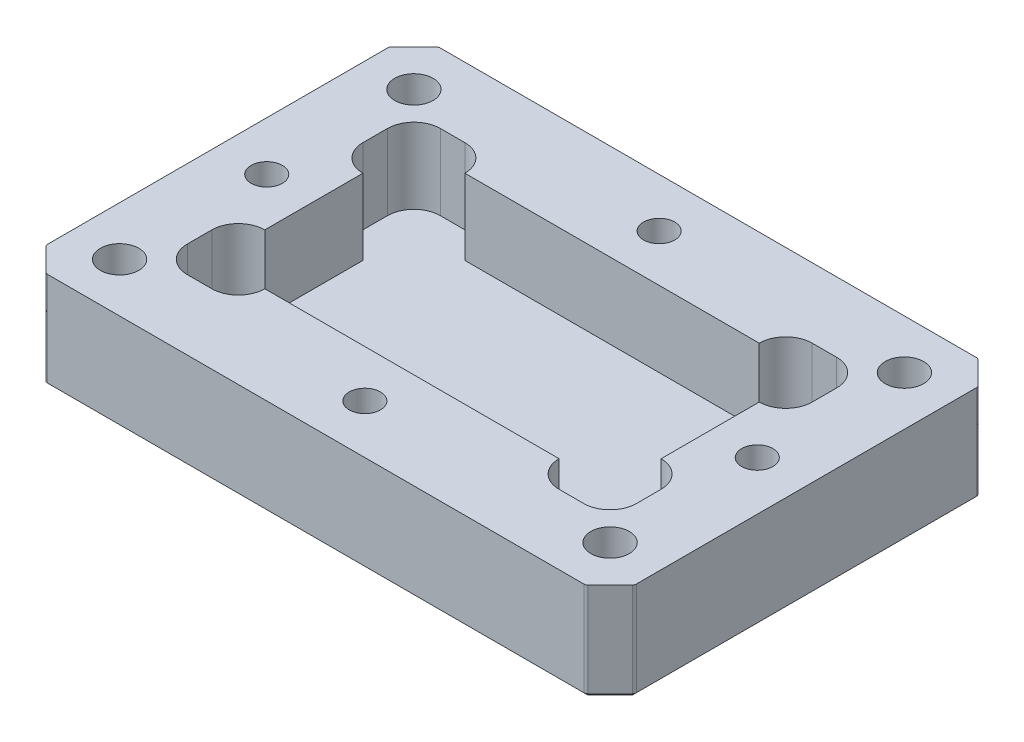
from build123d import *

# Parameters (mm, degrees)
SKETCH1_W                                      = 76.2
SKETCH1_H                                      = 50.8
BOSS_EXTRUDE1_DEPTH                            = 12.7
SKETCH2_W                                      = 51.308
SKETCH2_H                                      = 25.908
CUT_EXTRUDE1_DEPTH                             = 9.779
CUT_EXTRUDE2_DEPTH                             = 9.779
MIRROR2_COPY_1_DEPTH                           = 9.779
CBORE_FOR_10_SOCKET_HEAD_CAP_SCREW_D           = 4.9784
CBORE_FOR_10_SOCKET_HEAD_CAP_SCREW_CBORE_D     = 8.89
CBORE_FOR_10_SOCKET_HEAD_CAP_SCREW_CBORE_DEPTH = 5.08
CHAMFER1_SIZE                                  = 3.175
FILLET1_R                                      = 0.508
CHAMFER2_SIZE                                  = 0.508
F_10_32_TAPPED_HOLE1_D                         = 4.0386
CHAMFER3_SIZE                                  = 0.508


with BuildPart() as part:
    # Sketch1 → Boss-Extrude1 (new body)
    with BuildSketch(Plane(origin=(0, 0, 0), x_dir=(1, 0, 0), z_dir=(0, 1, 0))):
        Rectangle(SKETCH1_W, SKETCH1_H)
    extrude(amount=BOSS_EXTRUDE1_DEPTH)

    # Sketch2 → Cut-Extrude1 (cut)
    with BuildSketch(Plane(origin=(0, 12.7, 0), x_dir=(1, 0, 0), z_dir=(0, 1, 0))):
        Rectangle(SKETCH2_W, SKETCH2_H)
    extrude(amount=-CUT_EXTRUDE1_DEPTH, mode=Mode.SUBTRACT)

    # Sketch3 → Cut-Extrude2 (cut)
    with BuildSketch(Plane(origin=(0, 12.7, 0), x_dir=(1, 0, 0), z_dir=(0, 1, 0))):
        with BuildLine():
            Line((-22.479, 16.383), (-25.654, 16.383))
            ThreePointArc((-25.654, 16.383), (-28.078669153, 15.378669153), (-29.083, 12.954))
            Line((-29.083, 12.954), (-29.083, 9.779))
            ThreePointArc((-29.083, 9.779), (-26.96622149, 6.611017083), (-23.229330847, 7.354330847))
            Line((-23.229330847, 7.354330847), (-20.054330847, 10.529330847))
            ThreePointArc((-20.054330847, 10.529330847), (-19.311017083, 14.26622149), (-22.479, 16.383))
        make_face()
    cut_extrude2 = extrude(amount=-CUT_EXTRUDE2_DEPTH, mode=Mode.SUBTRACT)

    # Mirror1: Cut-Extrude2 across plane
    add(cut_extrude2.mirror(Plane.XY), mode=Mode.SUBTRACT)

    # Mirror2: Cut-Extrude2 across plane
    add(cut_extrude2.mirror(Plane(origin=(0, 0, 0), x_dir=(0, 0, 1), z_dir=(1, 0, 0))), mode=Mode.SUBTRACT)

    # Mirror2 copy 1 sketch → Mirror2 copy 1 (cut)
    with BuildSketch(Plane(origin=(0, 12.7, 0), x_dir=(-1, 0, 0), z_dir=(0, 1, 0))):
        with BuildLine():
            Line((-22.479, 16.383), (-25.654, 16.383))
            ThreePointArc((-25.654, 16.383), (-28.078669153, 15.378669153), (-29.083, 12.954))
            Line((-29.083, 12.954), (-29.083, 9.779))
            ThreePointArc((-29.083, 9.779), (-26.96622149, 6.611017083), (-23.229330847, 7.354330847))
            Line((-23.229330847, 7.354330847), (-20.054330847, 10.529330847))
            ThreePointArc((-20.054330847, 10.529330847), (-19.311017083, 14.26622149), (-22.479, 16.383))
        make_face()
    extrude(amount=-MIRROR2_COPY_1_DEPTH, mode=Mode.SUBTRACT)

    # CBORE for #10 Socket Head Cap Screw (through all)
    with Locations(Plane(origin=(-13.395092078, 0, 69.634435184), x_dir=(1, 0, 0), z_dir=(0, -1, 0))):
        with Locations((-18.354907922, -50.584435184), (45.145092078, -50.584435184), (45.145092078, -88.684435184), (-18.354907922, -88.684435184)):
            CounterBoreHole(CBORE_FOR_10_SOCKET_HEAD_CAP_SCREW_D / 2, CBORE_FOR_10_SOCKET_HEAD_CAP_SCREW_CBORE_D / 2, CBORE_FOR_10_SOCKET_HEAD_CAP_SCREW_CBORE_DEPTH)

    # Chamfer1
    chamfer1_edges = [part.edges().sort_by_distance(p)[0] for p in [
        (38.1, 6.35, 25.4),
        (-38.1, 6.35, 25.4),
        (-38.1, 6.35, -25.4),
        (38.1, 6.35, -25.4),
    ]]
    chamfer(chamfer1_edges, length=CHAMFER1_SIZE)

    # Fillet1
    fillet1_edges = [part.edges().sort_by_distance(p)[0] for p in [
        (38.1, 6.35, -22.225),
        (38.1, 6.35, 22.225),
        (-34.925, 6.35, 25.4),
        (34.925, 6.35, 25.4),
        (-34.925, 6.35, -25.4),
        (34.925, 6.35, -25.4),
        (-38.1, 6.35, -22.225),
        (-38.1, 6.35, 22.225),
    ]]
    fillet(fillet1_edges, radius=FILLET1_R)

    # Chamfer2
    chamfer2_edges = [part.edges().sort_by_distance(p)[0] for p in [
        (-38.1, 0, 0),
        (38.1, 0, 0),
        (36.5125, 0, 23.8125),
        (0, 0, 25.4),
        (-36.5125, 0, 23.8125),
        (-36.5125, 0, -23.8125),
        (0, 0, -25.4),
        (36.5125, 0, -23.8125),
        (-34.908982694, 0, 25.361330803),
        (-38.061330803, 0, 22.208982694),
        (34.908982694, 0, 25.361330803),
        (38.061330803, 0, 22.208982694),
        (38.061330803, 0, -22.208982694),
        (34.908982694, 0, -25.361330803),
        (-34.908982694, 0, -25.361330803),
        (-38.061330803, 0, -22.208982694),
    ]]
    chamfer(chamfer2_edges, length=CHAMFER2_SIZE)

    # #10-32 Tapped Hole1 (through all)
    with Locations(Plane(origin=(0, 0, 0), x_dir=(-1, 0, 0), z_dir=(0, -1, 0))):
        with Locations((-31.75, 0), (31.75, 0), (0, 19.05), (0, -19.05)):
            Hole(F_10_32_TAPPED_HOLE1_D / 2)

    # Chamfer3
    chamfer3_edges = [part.edges().sort_by_distance(p)[0] for p in [
        (-36.195, 0, -19.05),
        (27.305, 0, -19.05),
        (27.305, 0, 19.05),
        (-36.195, 0, 19.05),
    ]]
    chamfer(chamfer3_edges, length=CHAMFER3_SIZE)


solid = part.part
